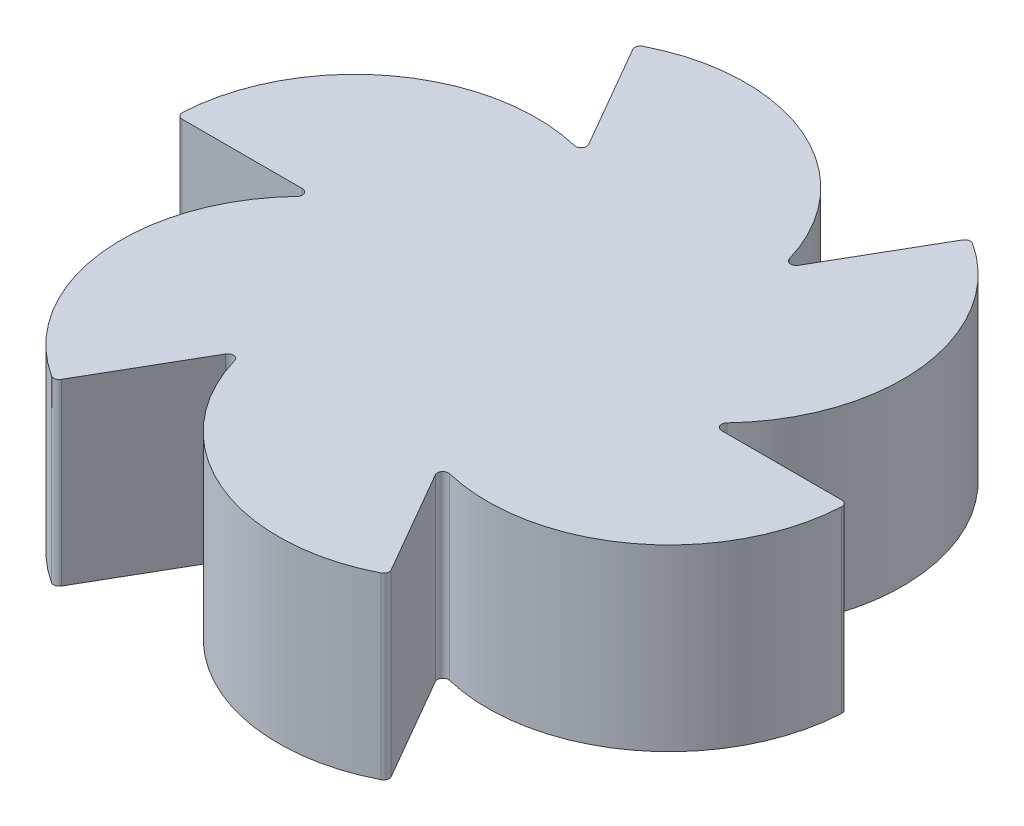
from build123d import *

# Parameters (mm, degrees)
BOSS_EXTRUDE1_DEPTH = 1.4
FILLET1_R           = 0.2
SKETCH2_R           = 4.3
BOSS_EXTRUDE2_DEPTH = 2.5
SKETCH2_3_R         = 4.3
BOSS_EXTRUDE3_DEPTH = 5


with BuildPart() as part:
    # Sketch1 → Boss-Extrude1 (new body)
    with BuildSketch(Plane(origin=(0, 0, 0), x_dir=(1, 0, 0), z_dir=(0, 1, 0))):
        with BuildLine():
            ThreePointArc((-6, -10.392304845), (-9.114938352, -5.447774983), (-7, 0))
            Line((-7, 0), (-12, 0))
            ThreePointArc((-12, 0), (-9.275380706, 5.169880676), (-3.5, 6.062177826))
            Line((-3.5, 6.062177826), (-6, 10.392304845))
            ThreePointArc((-6, 10.392304845), (-0.160442353, 10.617655659), (3.5, 6.062177826))
            Line((3.5, 6.062177826), (6, 10.392304845))
            ThreePointArc((6, 10.392304845), (9.114938352, 5.447774983), (7, 0))
            Line((7, 0), (12, 0))
            ThreePointArc((12, 0), (9.275380706, -5.169880676), (3.5, -6.062177826))
            Line((3.5, -6.062177826), (6, -10.392304845))
            ThreePointArc((6, -10.392304845), (0.160442353, -10.617655659), (-3.5, -6.062177826))
            Line((-3.5, -6.062177826), (-6, -10.392304845))
        make_face()
    extrude(amount=BOSS_EXTRUDE1_DEPTH)

    # Fillet1
    fillet1_edges = [part.edges().sort_by_distance(p)[0] for p in [
        (7, 0.7, 0),
        (12, 0.7, 0),
        (3.5, 0.7, 6.062177826),
        (6, 0.7, 10.392304845),
        (-3.5, 0.7, 6.062177826),
        (-6, 0.7, 10.392304845),
        (-7, 0.7, 0),
        (-12, 0.7, 0),
        (-3.5, 0.7, -6.062177826),
        (-6, 0.7, -10.392304845),
        (3.5, 0.7, -6.062177826),
        (6, 0.7, -10.392304845),
    ]]
    fillet(fillet1_edges, radius=FILLET1_R)

    # Sketch2 → Boss-Extrude2 (add)
    # profile 1 of 2: a face of its own
    with BuildSketch(Plane.XZ):
        with BuildLine():
            ThreePointArc((7.3475601, -0.33806531), (7.308394161, -0.121301404), (7.492259685, 0))
            Line((7.492259685, 0), (11.792907204, 0))
            ThreePointArc((11.792907204, 0), (11.937898824, 0.062241407), (11.99264562, 0.2102257))
            ThreePointArc((11.99264562, 0.2102257), (9.386315888, 5.088980867), (3.966553197, 6.194141047))
            ThreePointArc((3.966553197, 6.194141047), (3.759247178, 6.268604302), (3.746129843, 6.488487219))
            Line((3.746129843, 6.488487219), (5.896453602, 10.212957223))
            ThreePointArc((5.896453602, 10.212957223), (5.915046773, 10.369644353), (5.814262013, 10.491048616))
            ThreePointArc((5.814262013, 10.491048616), (0.285971234, 10.673278441), (-3.381006903, 6.532206358))
            ThreePointArc((-3.381006903, 6.532206358), (-3.549146983, 6.389905707), (-3.746129843, 6.488487219))
            Line((-3.746129843, 6.488487219), (-5.896453602, 10.212957223))
            ThreePointArc((-5.896453602, 10.212957223), (-6.022852052, 10.307402946), (-6.178383607, 10.280822916))
            ThreePointArc((-6.178383607, 10.280822916), (-9.100344655, 5.584297574), (-7.3475601, 0.33806531))
            ThreePointArc((-7.3475601, 0.33806531), (-7.308394161, 0.121301404), (-7.492259685, 0))
            Line((-7.492259685, 0), (-11.792907204, 0))
            ThreePointArc((-11.792907204, 0), (-11.937898824, -0.062241407), (-11.99264562, -0.2102257))
            ThreePointArc((-11.99264562, -0.2102257), (-9.386315888, -5.088980867), (-3.966553197, -6.194141047))
            ThreePointArc((-3.966553197, -6.194141047), (-3.759247178, -6.268604302), (-3.746129843, -6.488487219))
            Line((-3.746129843, -6.488487219), (-5.896453602, -10.212957223))
            ThreePointArc((-5.896453602, -10.212957223), (-5.915046773, -10.369644353), (-5.814262013, -10.491048616))
            ThreePointArc((-5.814262013, -10.491048616), (-0.285971234, -10.673278441), (3.381006903, -6.532206358))
            ThreePointArc((3.381006903, -6.532206358), (3.549146983, -6.389905707), (3.746129843, -6.488487219))
            Line((3.746129843, -6.488487219), (5.896453602, -10.212957223))
            ThreePointArc((5.896453602, -10.212957223), (6.022852052, -10.307402946), (6.178383607, -10.280822916))
            ThreePointArc((6.178383607, -10.280822916), (9.100344655, -5.584297574), (7.3475601, -0.33806531))
        make_face()
        Circle(SKETCH2_R, mode=Mode.SUBTRACT)
    # profile 2 of 2: a face of its own
    with BuildSketch(Plane.XZ):
        Polygon((1.125833025, -1.95), (2.25166605, 0), (1.125833025, 1.95), (-1.125833025, 1.95), (-2.25166605, 0), (-1.125833025, -1.95), align=None)
    extrude(amount=BOSS_EXTRUDE2_DEPTH)

    # Sketch2<3> → Boss-Extrude3 (add)
    with BuildSketch(Plane.XZ):
        with BuildLine():
            ThreePointArc((7.3475601, -0.33806531), (7.308394161, -0.121301404), (7.492259685, 0))
            Line((7.492259685, 0), (11.792907204, 0))
            ThreePointArc((11.792907204, 0), (11.937898824, 0.062241407), (11.99264562, 0.2102257))
            ThreePointArc((11.99264562, 0.2102257), (9.386315888, 5.088980867), (3.966553197, 6.194141047))
            ThreePointArc((3.966553197, 6.194141047), (3.759247178, 6.268604302), (3.746129843, 6.488487219))
            Line((3.746129843, 6.488487219), (5.896453602, 10.212957223))
            ThreePointArc((5.896453602, 10.212957223), (5.915046773, 10.369644353), (5.814262013, 10.491048616))
            ThreePointArc((5.814262013, 10.491048616), (0.285971234, 10.673278441), (-3.381006903, 6.532206358))
            ThreePointArc((-3.381006903, 6.532206358), (-3.549146983, 6.389905707), (-3.746129843, 6.488487219))
            Line((-3.746129843, 6.488487219), (-5.896453602, 10.212957223))
            ThreePointArc((-5.896453602, 10.212957223), (-6.022852052, 10.307402946), (-6.178383607, 10.280822916))
            ThreePointArc((-6.178383607, 10.280822916), (-9.100344655, 5.584297574), (-7.3475601, 0.33806531))
            ThreePointArc((-7.3475601, 0.33806531), (-7.308394161, 0.121301404), (-7.492259685, 0))
            Line((-7.492259685, 0), (-11.792907204, 0))
            ThreePointArc((-11.792907204, 0), (-11.937898824, -0.062241407), (-11.99264562, -0.2102257))
            ThreePointArc((-11.99264562, -0.2102257), (-9.386315888, -5.088980867), (-3.966553197, -6.194141047))
            ThreePointArc((-3.966553197, -6.194141047), (-3.759247178, -6.268604302), (-3.746129843, -6.488487219))
            Line((-3.746129843, -6.488487219), (-5.896453602, -10.212957223))
            ThreePointArc((-5.896453602, -10.212957223), (-5.915046773, -10.369644353), (-5.814262013, -10.491048616))
            ThreePointArc((-5.814262013, -10.491048616), (-0.285971234, -10.673278441), (3.381006903, -6.532206358))
            ThreePointArc((3.381006903, -6.532206358), (3.549146983, -6.389905707), (3.746129843, -6.488487219))
            Line((3.746129843, -6.488487219), (5.896453602, -10.212957223))
            ThreePointArc((5.896453602, -10.212957223), (6.022852052, -10.307402946), (6.178383607, -10.280822916))
            ThreePointArc((6.178383607, -10.280822916), (9.100344655, -5.584297574), (7.3475601, -0.33806531))
        make_face()
        Circle(SKETCH2_3_R, mode=Mode.SUBTRACT)
    extrude(amount=BOSS_EXTRUDE3_DEPTH)


solid = part.part
